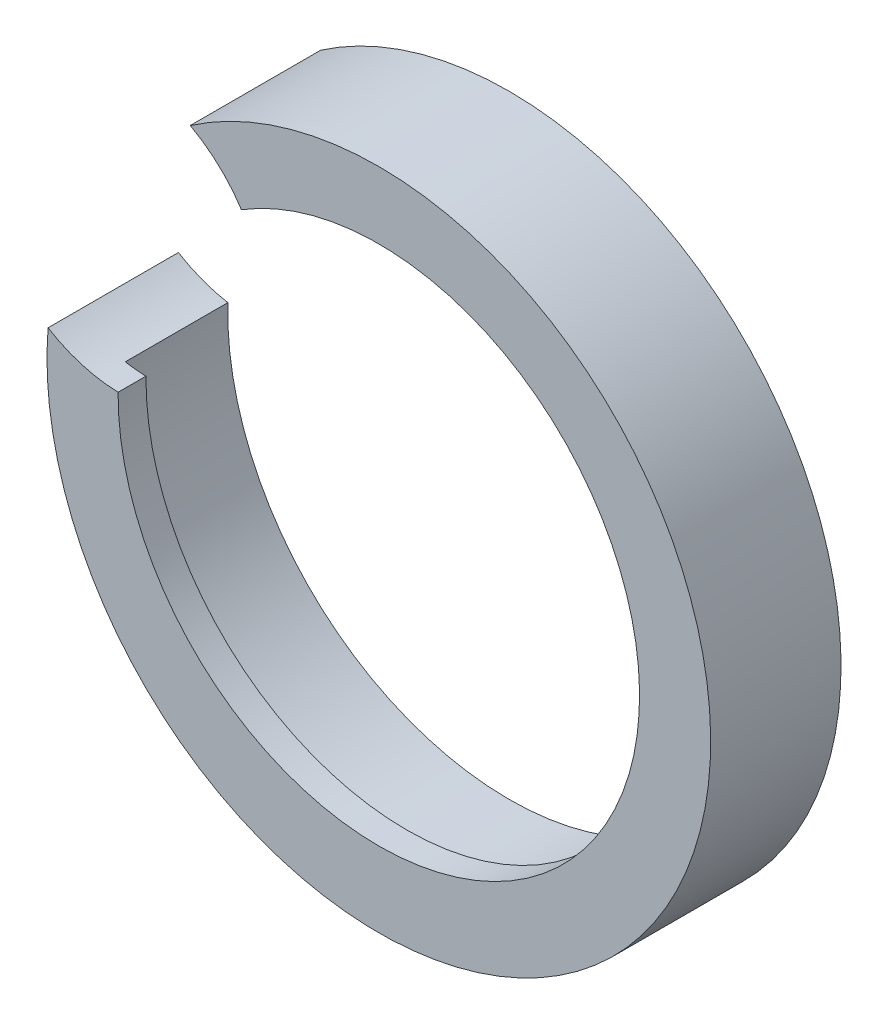
from build123d import *

# Parameters (mm, degrees)
SKETCH_1_R           = 56
SKETCH_1_R_2         = 47.5
EXTRUDE_1_DEPTH      = 20
EXTRUDE_3_DEPTH      = 2
EXTRUDE_3_DEPTH_BACK = 2.7
SKETCH_3_R           = 56
SKETCH_3_R_2         = 44
SKETCH_4_R           = 24
CUT_EXTRUDE_1_DEPTH  = 83.194890352


with BuildPart() as part:
    # 草图1 → 凸台-拉伸1 (new body)
    with BuildSketch(Plane.XY):
        Circle(SKETCH_1_R)
        Circle(SKETCH_1_R_2, mode=Mode.SUBTRACT)
    extrude(amount=EXTRUDE_1_DEPTH)

    # 草图3 → 凸台-拉伸3 (add, two sides: drawn at the far end of the back side and taken through both)
    with BuildSketch(Plane.XY.offset(20).offset(-EXTRUDE_3_DEPTH_BACK)):
        Circle(SKETCH_3_R)
        with Locations((0, 0.69041818)):
            Circle(SKETCH_3_R_2, mode=Mode.SUBTRACT)
    extrude(amount=EXTRUDE_3_DEPTH + EXTRUDE_3_DEPTH_BACK)

    # 草图4 → 切除-拉伸1 (cut, through all)
    with BuildSketch(Plane(origin=(0, 0, 0), x_dir=(-1, 0, 0), z_dir=(0, 0, -1))):
        with Locations((43.301270189, 25)):
            Circle(SKETCH_4_R)
    extrude(amount=-CUT_EXTRUDE_1_DEPTH, mode=Mode.SUBTRACT)


solid = part.part
